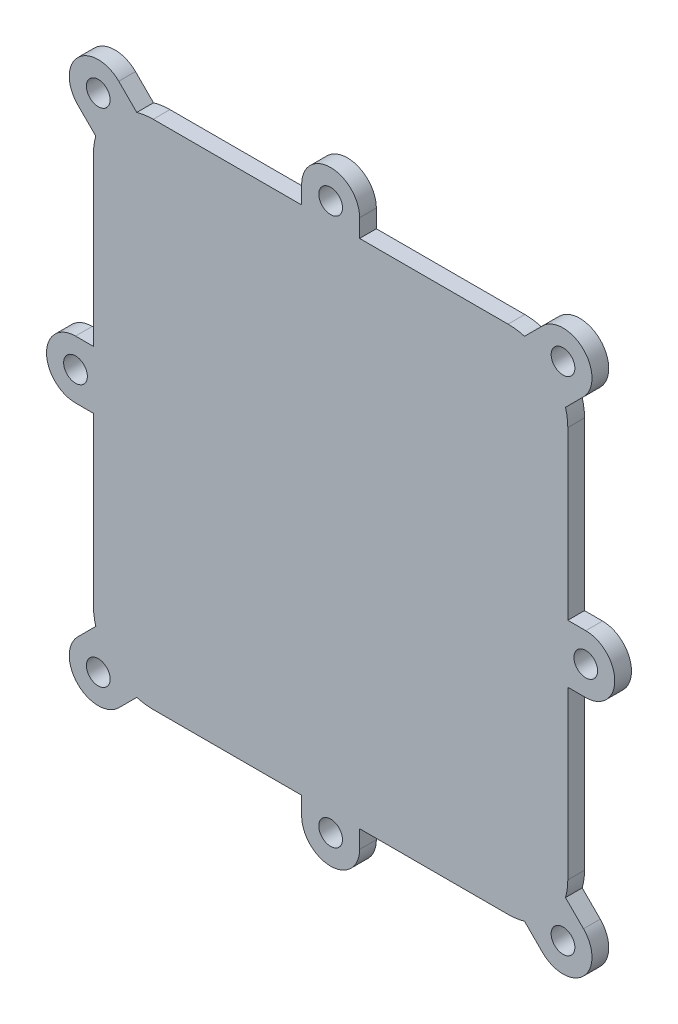
from build123d import *

# Parameters (mm, degrees)
BOSS_EXTRUDE1_DEPTH  = 3.175
M4_CLEARANCE_HOLE1_D = 4.5


with BuildPart() as part:
    # Sketch1 → Boss-Extrude1 (new body)
    with BuildSketch(Plane.XY):
        with BuildLine():
            Line((37.350187889, -76.716042997), (65.516187889, -76.716042997))
            Line((65.516187889, -76.716042997), (65.516187889, -80.125742997))
            ThreePointArc((65.516187889, -80.125742997), (71.016187889, -85.625742997), (76.516187889, -80.125742997))
            Line((76.516187889, -80.125742997), (76.516187889, -76.716042997))
            Line((76.516187889, -76.716042997), (104.682187889, -76.716042997))
            ThreePointArc((104.682187889, -76.716042997), (106.256649797, -76.606152124), (107.800580738, -76.278610439))
            Line((107.800580738, -76.278610439), (111.218470842, -79.696500543))
            ThreePointArc((111.218470842, -79.696500543), (118.996645435, -79.696500543), (118.996645435, -71.91832595))
            Line((118.996645435, -71.91832595), (115.578755331, -68.500435846))
            ThreePointArc((115.578755331, -68.500435846), (115.906297016, -66.956504905), (116.016187889, -65.382042997))
            Line((116.016187889, -65.382042997), (116.016187889, -33.716042997))
            Line((116.016187889, -33.716042997), (119.425887889, -33.716042997))
            ThreePointArc((119.425887889, -33.716042997), (124.925887889, -28.216042997), (119.425887889, -22.716042997))
            Line((119.425887889, -22.716042997), (116.016187889, -22.716042997))
            Line((116.016187889, -22.716042997), (116.016187889, 8.949957003))
            ThreePointArc((116.016187889, 8.949957003), (115.906297016, 10.524418912), (115.578755331, 12.068349853))
            Line((115.578755331, 12.068349853), (118.996645435, 15.486239957))
            ThreePointArc((118.996645435, 15.486239957), (118.996645435, 23.26441455), (111.218470842, 23.26441455))
            Line((111.218470842, 23.26441455), (107.800580738, 19.846524446))
            ThreePointArc((107.800580738, 19.846524446), (106.256649797, 20.174066131), (104.682187889, 20.283957003))
            Line((104.682187889, 20.283957003), (76.516187889, 20.283957003))
            Line((76.516187889, 20.283957003), (76.516187889, 23.693657003))
            ThreePointArc((76.516187889, 23.693657003), (71.016187889, 29.193657003), (65.516187889, 23.693657003))
            Line((65.516187889, 23.693657003), (65.516187889, 20.283957003))
            Line((65.516187889, 20.283957003), (37.350187889, 20.283957003))
            ThreePointArc((37.350187889, 20.283957003), (35.77572598, 20.174066131), (34.231795039, 19.846524446))
            Line((34.231795039, 19.846524446), (30.813904935, 23.26441455))
            ThreePointArc((30.813904935, 23.26441455), (23.035730342, 23.26441455), (23.035730342, 15.486239957))
            Line((23.035730342, 15.486239957), (26.453620446, 12.068349853))
            ThreePointArc((26.453620446, 12.068349853), (26.126078761, 10.524418912), (26.016187889, 8.949957003))
            Line((26.016187889, 8.949957003), (26.016187889, -22.716042997))
            Line((26.016187889, -22.716042997), (22.606487889, -22.716042997))
            ThreePointArc((22.606487889, -22.716042997), (17.106487889, -28.216042997), (22.606487889, -33.716042997))
            Line((22.606487889, -33.716042997), (26.016187889, -33.716042997))
            Line((26.016187889, -33.716042997), (26.016187889, -65.382042997))
            ThreePointArc((26.016187889, -65.382042997), (26.126078761, -66.956504905), (26.453620446, -68.500435846))
            Line((26.453620446, -68.500435846), (23.035730342, -71.91832595))
            ThreePointArc((23.035730342, -71.91832595), (23.035730342, -79.696500543), (30.813904935, -79.696500543))
            Line((30.813904935, -79.696500543), (34.231795039, -76.278610439))
            ThreePointArc((34.231795039, -76.278610439), (35.77572598, -76.606152124), (37.350187889, -76.716042997))
        make_face()
    extrude(amount=BOSS_EXTRUDE1_DEPTH)

    # M4 Clearance Hole1 (through all)
    with Locations(Plane.XY.offset(3.175)):
        with Locations((26.924817639, -75.807413246), (22.606487889, -28.216042997), (71.016187889, -80.125742997), (115.107558138, -75.807413246), (119.425887889, -28.216042997), (115.107558138, 19.375327253), (71.016187889, 23.693657003), (26.924817639, 19.375327253)):
            Hole(M4_CLEARANCE_HOLE1_D / 2)


solid = part.part
